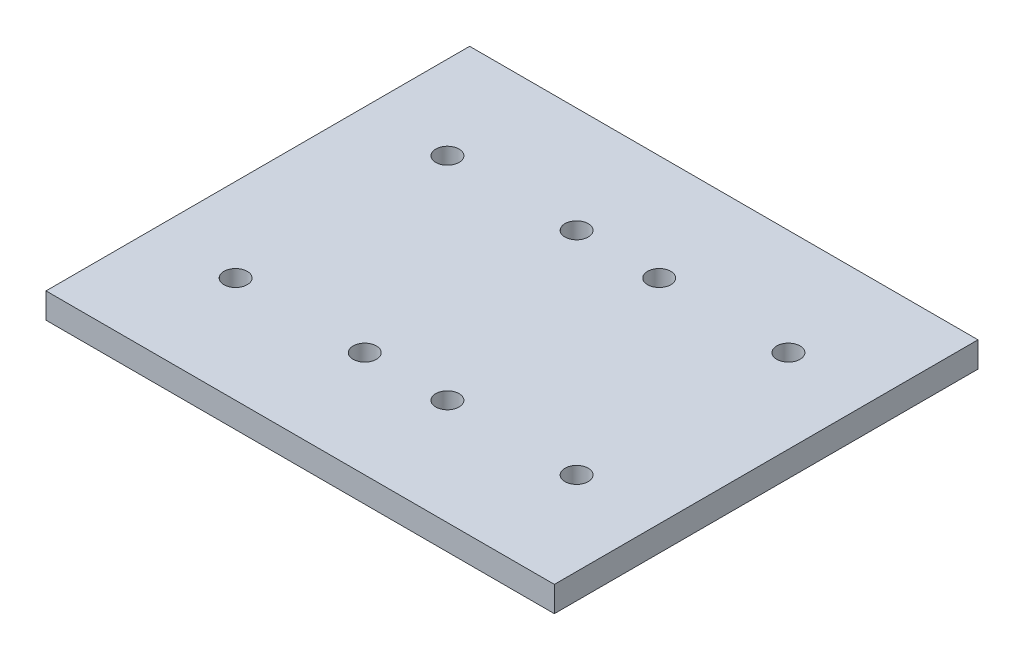
from build123d import *

# Parameters (mm, degrees)
ESBO_O1_W                = 120
ESBO_O1_H                = 100
RESSALTO_EXTRUS_O1_DEPTH = 6
ESBO_O2_R                = 2.75
CORTE_EXTRUS_O1_DEPTH    = 79.33262411


with BuildPart() as part:
    # Esboço1 → Ressalto-extrusão1 (new body)
    with BuildSketch(Plane(origin=(0, 0, 0), x_dir=(1, 0, 0), z_dir=(0, 1, 0))):
        Rectangle(ESBO_O1_W, ESBO_O1_H)
    extrude(amount=RESSALTO_EXTRUS_O1_DEPTH)

    # Esboço2 → Corte-extrusão1 (cut, through all)
    with BuildSketch(Plane(origin=(0, 6, 0), x_dir=(1, 0, 0), z_dir=(0, 1, 0))):
        with Locations(Location((9.75, 25, 0), (0, 0, 270))):
            Circle(ESBO_O2_R)
        with Locations(Location((40.25, 25, 0), (0, 0, 270))):
            Circle(ESBO_O2_R)
        with Locations(Location((9.75, -25, 0), (0, 0, 270))):
            Circle(ESBO_O2_R)
        with Locations(Location((40.25, -25, 0), (0, 0, 270))):
            Circle(ESBO_O2_R)
        with Locations(Location((-40.25, -25, 0), (0, 0, 90))):
            Circle(ESBO_O2_R)
        with Locations(Location((-9.75, -25, 0), (0, 0, 90))):
            Circle(ESBO_O2_R)
        with Locations(Location((-40.25, 25, 0), (0, 0, 90))):
            Circle(ESBO_O2_R)
        with Locations(Location((-9.75, 25, 0), (0, 0, 90))):
            Circle(ESBO_O2_R)
    extrude(amount=-CORTE_EXTRUS_O1_DEPTH, mode=Mode.SUBTRACT)


solid = part.part
